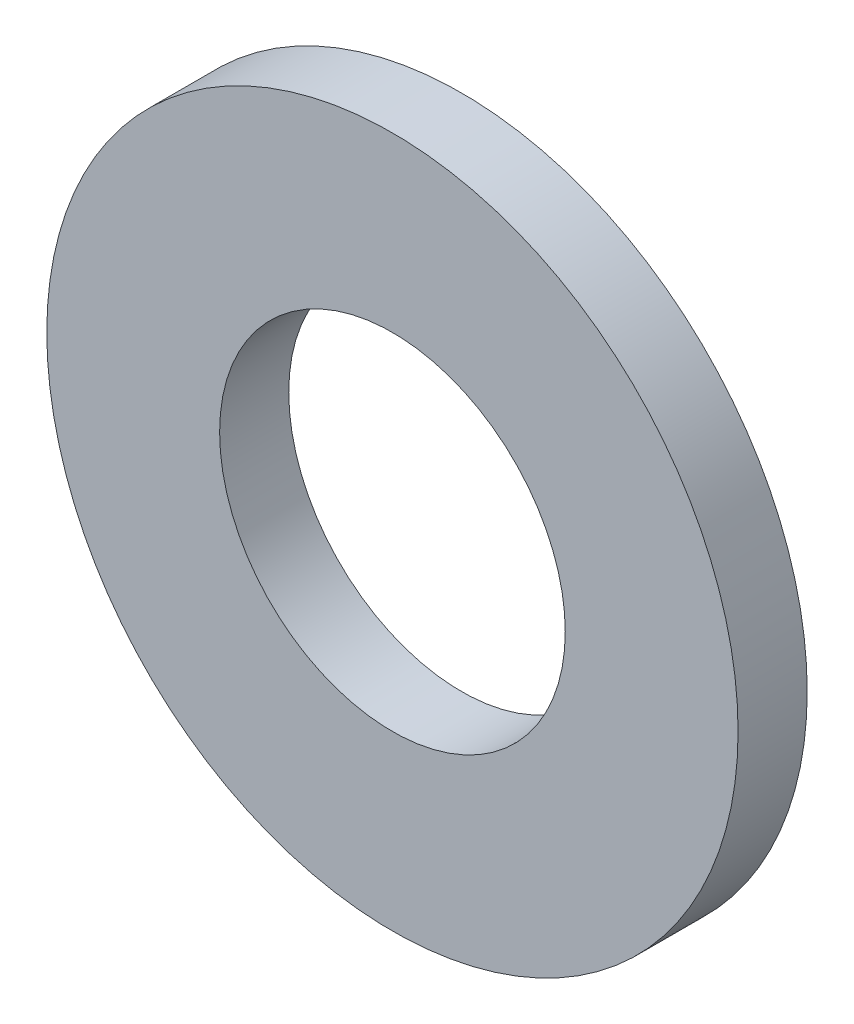
from build123d import *

# Parameters (mm, degrees)
SKETCH1_R      = 7.9375
SKETCH1_R_2    = 3.96875
EXTRUDE1_DEPTH = 0.79375


with BuildPart() as part:
    # Sketch1 → Extrude1 (new, symmetric)
    with BuildSketch(Plane.XY):
        Circle(SKETCH1_R)
        Circle(SKETCH1_R_2, mode=Mode.SUBTRACT)
    extrude(amount=EXTRUDE1_DEPTH, both=True)


solid = part.part
